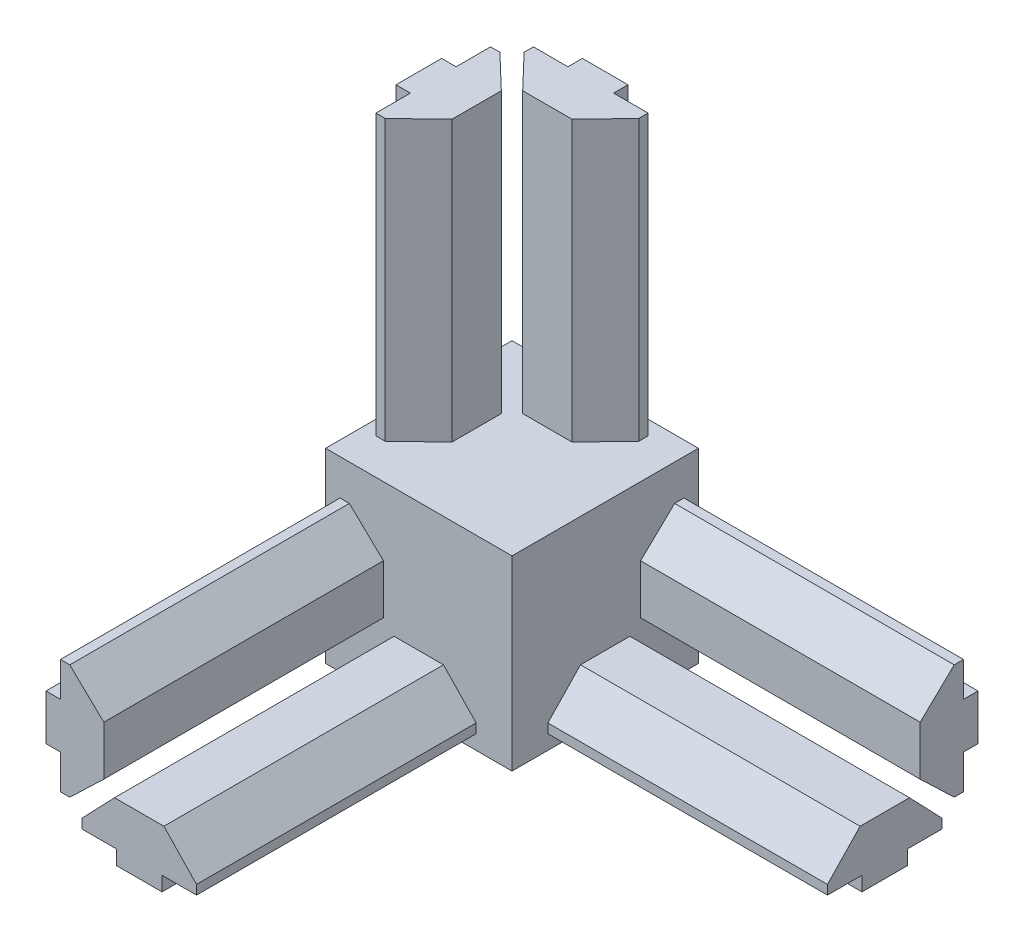
from build123d import *

# Parameters (mm, degrees)
ESQUISSE1_W        = 20
ESQUISSE1_H        = 20
BOSS_EXTRU_1_DEPTH = 20
BOSS_EXTRU_2_DEPTH = 30
BOSS_EXTRU_3_DEPTH = 30
BOSS_EXTRU_4_DEPTH = 30
BOSS_EXTRU_5_DEPTH = 30
BOSS_EXTRU_6_DEPTH = 30
BOSS_EXTRU_7_DEPTH = 30


with BuildPart() as part:
    # Esquisse1 → Boss.-Extru.1 (new body)
    with BuildSketch(Plane.XY):
        with Locations((-38.912352392, 11.232287948)):
            Rectangle(ESQUISSE1_W, ESQUISSE1_H)
    extrude(amount=BOSS_EXTRU_1_DEPTH)

    # Esquisse2 → Boss.-Extru.2 (add)
    with BuildSketch(Plane.XY.offset(20)):
        Polygon((-41.362352392, 1.232287948), (-41.362352392, 2.782287948), (-45.062352392, 2.782287948), (-45.062352392, 3.782287948), (-41.562352392, 7.436545738), (-36.262352392, 7.436545738), (-32.762352392, 3.782287948), (-32.762352392, 2.782287948), (-36.462352392, 2.782287948), (-36.462352392, 1.232287948), align=None)
    extrude(amount=BOSS_EXTRU_2_DEPTH)

    # Esquisse3 → Boss.-Extru.3 (add)
    with BuildSketch(Plane(origin=(-28.912352392, 0, 0), x_dir=(0, 0, -1), z_dir=(1, 0, 0))):
        Polygon((0, 8.782287948), (-1.55, 8.782287948), (-1.55, 5.082287948), (-2.55, 5.082287948), (-6.204257791, 8.582287948), (-6.204257791, 13.882287948), (-2.55, 17.382287948), (-1.55, 17.382287948), (-1.55, 13.682287948), (0, 13.682287948), align=None)
    extrude(amount=BOSS_EXTRU_3_DEPTH)

    # Esquisse4 → Boss.-Extru.4 (add)
    with BuildSketch(Plane(origin=(0, 21.232287948, 0), x_dir=(1, 0, 0), z_dir=(0, 1, 0))):
        Polygon((-36.462352392, 0), (-36.462352392, -1.55), (-32.762352392, -1.55), (-32.762352392, -2.55), (-36.262352392, -6.204257791), (-41.562352392, -6.204257791), (-45.062352392, -2.55), (-45.062352392, -1.55), (-41.362352392, -1.55), (-41.362352392, 0), align=None)
    extrude(amount=BOSS_EXTRU_4_DEPTH)

    # Esquisse6 → Boss.-Extru.5 (add)
    with BuildSketch(Plane(origin=(-28.912352392, 0, 0), x_dir=(0, 0, -1), z_dir=(1, 0, 0))):
        Polygon((-12.45, 1.232287948), (-12.45, 2.782287948), (-16.15, 2.782287948), (-16.15, 3.782287948), (-12.65, 7.436545738), (-7.35, 7.436545738), (-3.85, 3.782287948), (-3.85, 2.782287948), (-7.55, 2.782287948), (-7.55, 1.232287948), align=None)
    extrude(amount=BOSS_EXTRU_5_DEPTH)

    # Esquisse8 → Boss.-Extru.6 (add)
    with BuildSketch(Plane(origin=(0, 21.232287948, 0), x_dir=(1, 0, 0), z_dir=(0, 1, 0))):
        Polygon((-48.912352392, -7.55), (-47.362352392, -7.55), (-47.362352392, -3.85), (-46.362352392, -3.85), (-42.708094601, -7.35), (-42.708094601, -12.65), (-46.362352392, -16.15), (-47.362352392, -16.15), (-47.362352392, -12.45), (-48.912352392, -12.45), align=None)
    extrude(amount=BOSS_EXTRU_6_DEPTH)

    # Esquisse9 → Boss.-Extru.7 (add)
    with BuildSketch(Plane.XY.offset(20)):
        Polygon((-48.912352392, 13.682287948), (-47.362352392, 13.682287948), (-47.362352392, 17.382287948), (-46.362352392, 17.382287948), (-42.708094601, 13.882287948), (-42.708094601, 8.582287948), (-46.362352392, 5.082287948), (-47.362352392, 5.082287948), (-47.362352392, 8.782287948), (-48.912352392, 8.782287948), align=None)
    extrude(amount=BOSS_EXTRU_7_DEPTH)


solid = part.part
